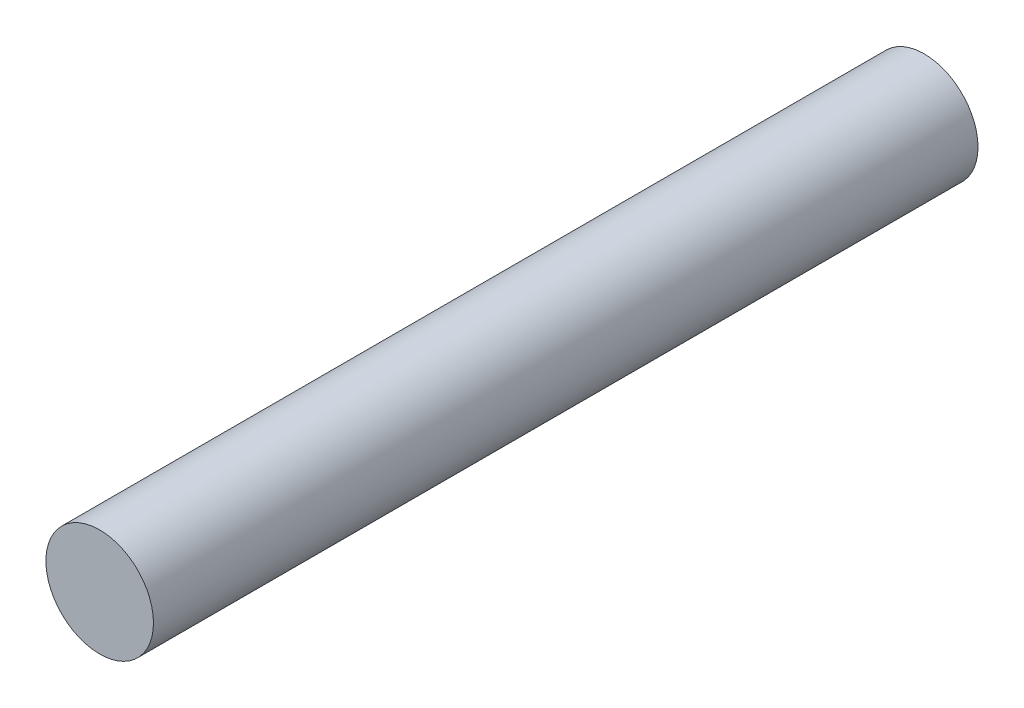
from build123d import *

# Parameters (mm, degrees)
SKETCH1_R           = 1.5
BOSS_EXTRUDE1_DEPTH = 23


with BuildPart() as part:
    # Sketch1 → Boss-Extrude1 (new body)
    with BuildSketch(Plane.XY):
        Circle(SKETCH1_R)
    extrude(amount=BOSS_EXTRUDE1_DEPTH)


solid = part.part
